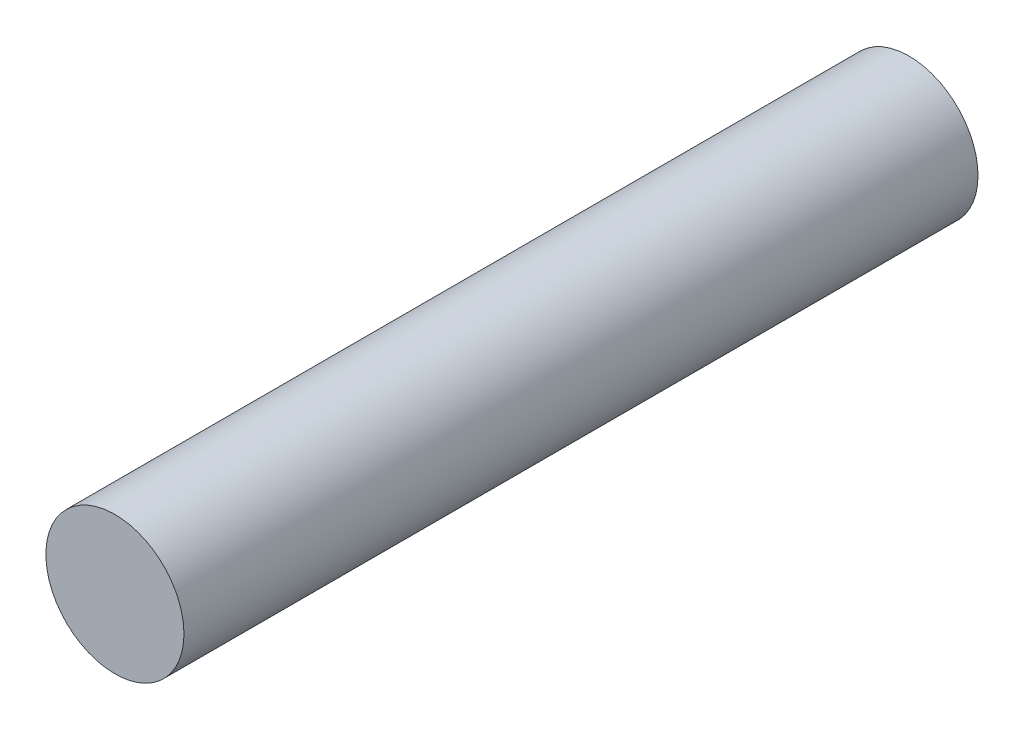
from build123d import *

# Parameters (mm, degrees)
SKETCH1_R           = 4
BOSS_EXTRUDE1_DEPTH = 46


with BuildPart() as part:
    # Sketch1 → Boss-Extrude1 (new body)
    with BuildSketch(Plane.XY):
        Circle(SKETCH1_R)
    extrude(amount=BOSS_EXTRUDE1_DEPTH)


solid = part.part
